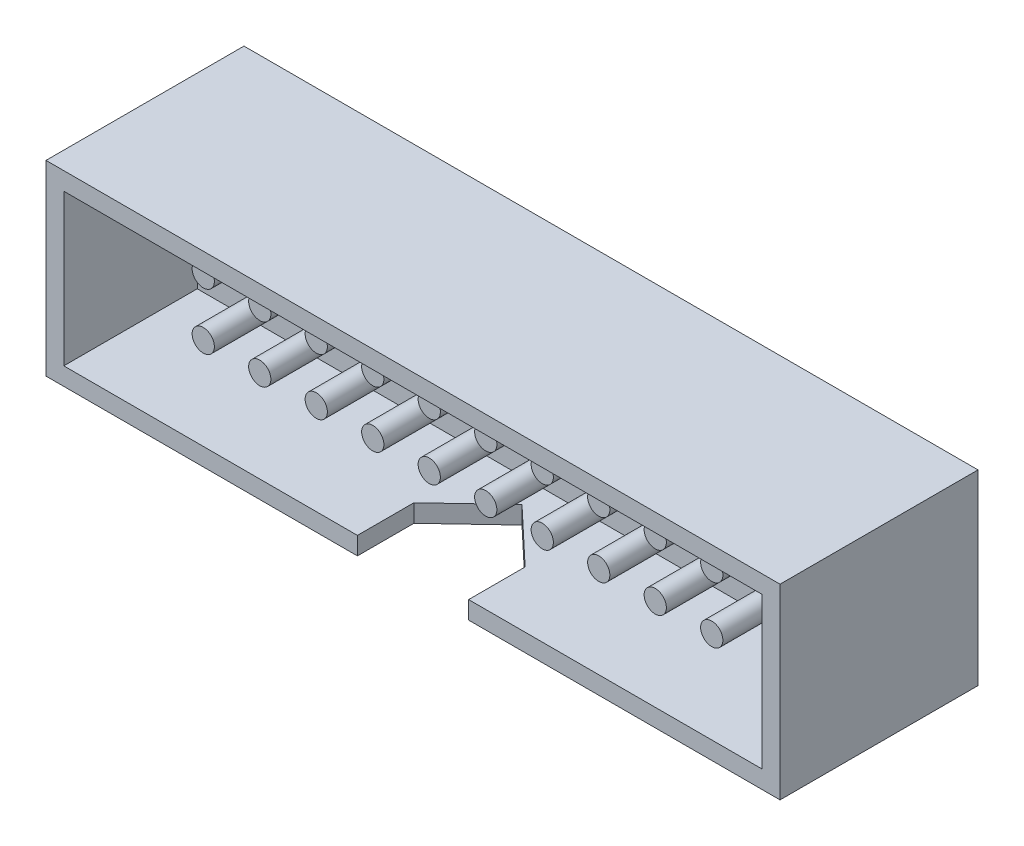
from build123d import *

# Parameters (mm, degrees)
SKETCH_1_W          = 33
SKETCH_1_H          = 8.4
EXTRUDE_1_DEPTH     = 8.9
SKETCH_2_W          = 31.4
SKETCH_2_H          = 6.8
CUT_EXTRUDE_1_DEPTH = 6
CUT_EXTRUDE_2_REACH = 37.196
SKETCH_4_R          = 0.5
EXTRUDE_2_DEPTH     = 4


with BuildPart() as part:
    # 草图1 → 凸台-拉伸1 (new body)
    with BuildSketch(Plane.XY):
        with Locations((16.5, -4.2)):
            Rectangle(SKETCH_1_W, SKETCH_1_H)
    extrude(amount=EXTRUDE_1_DEPTH)

    # 草图2 → 切除-拉伸1 (cut)
    with BuildSketch(Plane.XY.offset(8.9)):
        with Locations((16.5, -4.2)):
            Rectangle(SKETCH_2_W, SKETCH_2_H)
    extrude(amount=-CUT_EXTRUDE_1_DEPTH, mode=Mode.SUBTRACT)

    # 草图3 → 切除-拉伸2 (cut, up to next)
    with BuildSketch(Plane.XZ.offset(8.4), mode=Mode.PRIVATE) as cut_extrude_2_sk1:
        Polygon((14, 8.9), (14, 6.36), (16.5, 4), (19, 6.36), (19, 8.9), align=None)
    cut_extrude_2_tool1 = extrude(cut_extrude_2_sk1.sketch, amount=-CUT_EXTRUDE_2_REACH, mode=Mode.PRIVATE) & part.part
    add(cut_extrude_2_tool1.solids().sort_by_distance((16.5, -8.4, 6.977616))[0], mode=Mode.SUBTRACT)

    # 草图4 → 凸台-拉伸2 (add, symmetric)
    with BuildSketch(Plane.XY.offset(2.9)):
        with Locations(Location((20.31, -5.47, 0), (0, 0, 180))):
            Circle(SKETCH_4_R)
        with Locations(Location((17.77, -2.93, 0), (0, 0, 180))):
            Circle(SKETCH_4_R)
        with Locations(Location((20.31, -2.93, 0), (0, 0, 180))):
            Circle(SKETCH_4_R)
        with Locations(Location((22.85, -5.47, 0), (0, 0, 180))):
            Circle(SKETCH_4_R)
        with Locations(Location((22.85, -2.93, 0), (0, 0, 180))):
            Circle(SKETCH_4_R)
        with Locations(Location((25.39, -5.47, 0), (0, 0, 180))):
            Circle(SKETCH_4_R)
        with Locations(Location((17.77, -5.47, 0), (0, 0, 180))):
            Circle(SKETCH_4_R)
        with Locations(Location((25.39, -2.93, 0), (0, 0, 180))):
            Circle(SKETCH_4_R)
        with Locations(Location((27.93, -5.47, 0), (0, 0, 180))):
            Circle(SKETCH_4_R)
        with Locations(Location((27.93, -2.93, 0), (0, 0, 180))):
            Circle(SKETCH_4_R)
        with Locations(Location((5.07, -2.93, 0), (0, 0, 180))):
            Circle(SKETCH_4_R)
        with Locations(Location((5.07, -5.47, 0), (0, 0, 180))):
            Circle(SKETCH_4_R)
        with Locations(Location((7.61, -5.47, 0), (0, 0, 180))):
            Circle(SKETCH_4_R)
        with Locations(Location((7.61, -2.93, 0), (0, 0, 180))):
            Circle(SKETCH_4_R)
        with Locations(Location((10.15, -2.93, 0), (0, 0, 180))):
            Circle(SKETCH_4_R)
        with Locations(Location((10.15, -5.47, 0), (0, 0, 180))):
            Circle(SKETCH_4_R)
        with Locations(Location((12.69, -5.47, 0), (0, 0, 180))):
            Circle(SKETCH_4_R)
        with Locations(Location((12.69, -2.93, 0), (0, 0, 180))):
            Circle(SKETCH_4_R)
        with Locations(Location((15.23, -2.93, 0), (0, 0, 180))):
            Circle(SKETCH_4_R)
        with Locations(Location((15.23, -5.47, 0), (0, 0, 180))):
            Circle(SKETCH_4_R)
    extrude(amount=EXTRUDE_2_DEPTH, both=True)


solid = part.part
